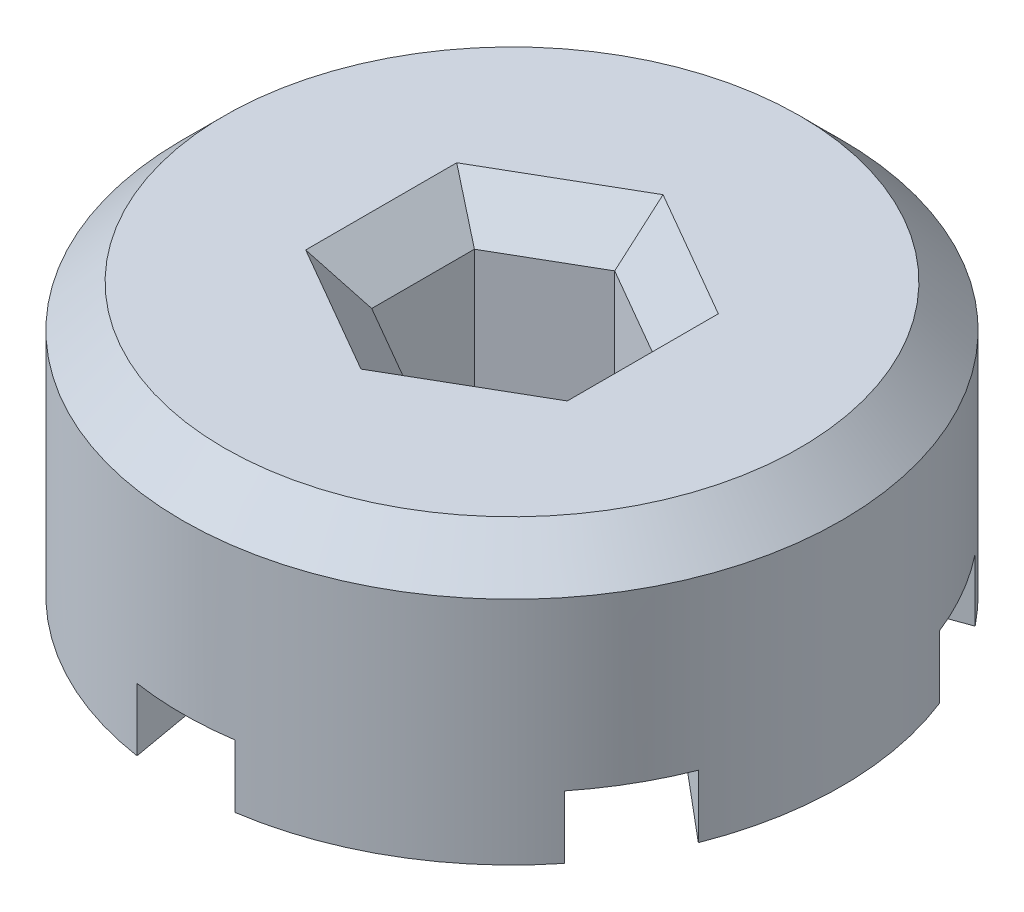
from build123d import *
from build123d.topology import SkipClean

# Parameters (mm, degrees)
SKETCH1_R           = 15.75
BOSS_EXTRUDE1_DEPTH = 10
CUT_EXTRUDE1_DEPTH  = 10
BOSS_EXTRUDE2_START = 3
BOSS_EXTRUDE2_DEPTH = 3
CHAMFER1_SIZE       = 2


with BuildPart() as part:
    # Sketch1 → Boss-Extrude1 (new body)
    with BuildSketch(Plane(origin=(0, 0, 0), x_dir=(1, 0, 0), z_dir=(0, 1, 0))):
        with Locations(Location((0, 0, 0), (0, 0, 270))):
            Circle(SKETCH1_R)
    extrude(amount=BOSS_EXTRUDE1_DEPTH)

    # Sketch2 → Cut-Extrude1 (cut)
    with BuildSketch(Plane(origin=(0, 10, 0), x_dir=(1, 0, 0), z_dir=(0, 1, 0))):
        Polygon((4.25, 2.453738644), (0, 4.907477288), (-4.25, 2.453738644), (-4.25, -2.453738644), (0, -4.907477288), (4.25, -2.453738644), align=None)
    extrude(amount=-CUT_EXTRUDE1_DEPTH, mode=Mode.SUBTRACT)

    # Sketch3 → Boss-Extrude2 (add)
    with SkipClean():  # the faces are left unmerged after this step: merging them gives an invalid solid
        with BuildSketch(Plane.XZ.offset(BOSS_EXTRUDE2_START)):
            with BuildLine():
                Line((-14.660328147, -5.756498818), (-7.8, 0))
                Line((-7.8, 0), (-14.660328147, 5.756498818))
                ThreePointArc((-14.660328147, 5.756498818), (-15.75, 0), (-14.660328147, -5.756498818))
            make_face()
            with BuildLine():
                Line((-3.9, -6.75499815), (-12.315438286, -9.817967194))
                ThreePointArc((-12.315438286, -9.817967194), (-7.875, -13.63990011), (-2.34488986, -15.574466011))
                Line((-2.34488986, -15.574466011), (-3.9, -6.75499815))
            make_face()
            with BuildLine():
                Line((3.9, -6.75499815), (2.34488986, -15.574466011))
                ThreePointArc((2.34488986, -15.574466011), (7.875, -13.63990011), (12.315438286, -9.817967194))
                Line((12.315438286, -9.817967194), (3.9, -6.75499815))
            make_face()
            with BuildLine():
                Line((7.8, 0), (14.660328147, -5.756498818))
                ThreePointArc((14.660328147, -5.756498818), (15.475184463, -2.929362703), (15.75, 0))
                ThreePointArc((15.75, 0), (15.475184463, 2.929362703), (14.660328147, 5.756498818))
                Line((14.660328147, 5.756498818), (7.8, 0))
            make_face()
            with BuildLine():
                ThreePointArc((12.315438286, 9.817967194), (7.875, 13.63990011), (2.34488986, 15.574466011))
                Line((2.34488986, 15.574466011), (3.9, 6.75499815))
                Line((3.9, 6.75499815), (12.315438286, 9.817967194))
            make_face()
            with BuildLine():
                ThreePointArc((-2.34488986, 15.574466011), (-7.875, 13.63990011), (-12.315438286, 9.817967194))
                Line((-12.315438286, 9.817967194), (-3.9, 6.75499815))
                Line((-3.9, 6.75499815), (-2.34488986, 15.574466011))
            make_face()
        extrude(amount=-BOSS_EXTRUDE2_DEPTH)

    # Chamfer1
    chamfer1_edges = [part.edges().sort_by_distance(p)[0] for p in [
        (4.25, 10, 0),
        (2.125, 10, -3.680607966),
        (-2.125, 10, -3.680607966),
        (-4.25, 10, 0),
        (-2.125, 10, 3.680607966),
        (2.125, 10, 3.680607966),
        (0, 10, -15.75),
    ]]
    chamfer(chamfer1_edges, length=CHAMFER1_SIZE)


solid = part.part
